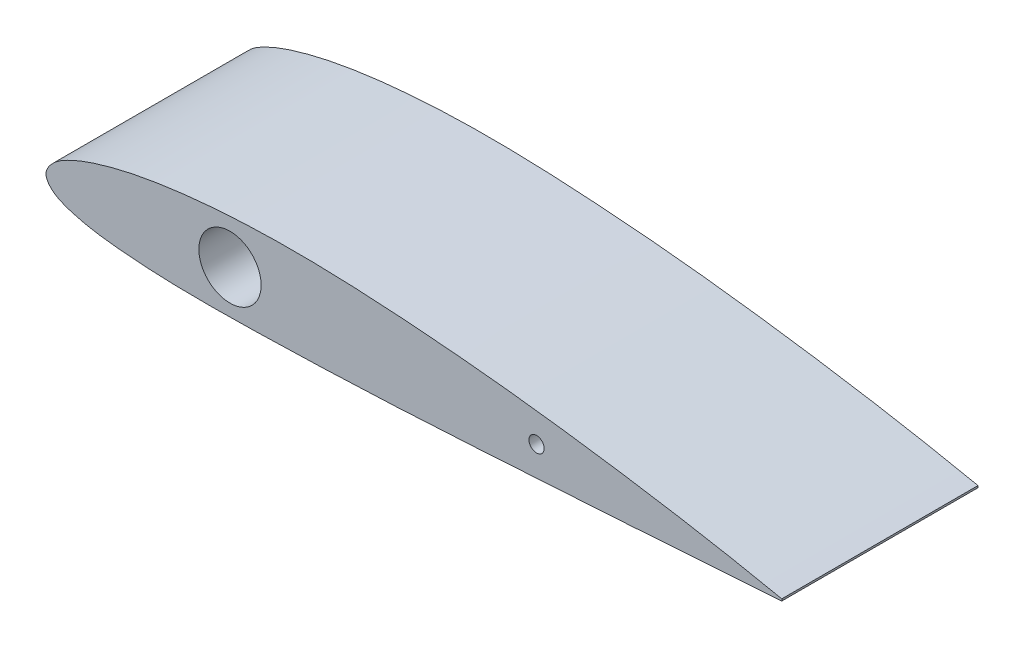
from build123d import *

# Parameters (mm, degrees)
SKETCH1_R           = 12.7
SKETCH1_R_2         = 3.1
BOSS_EXTRUDE1_DEPTH = 80


with BuildPart() as part:
    # Sketch1 → Boss-Extrude1 (new body)
    with BuildSketch(Plane.XY):
        with BuildLine():
            Line((269.75606318, 0.39), (269.75606318, -0.39))
            add(Edge.make_bspline(
                [(269.75606318, 0.39), (264.758836378, 1.414000082), (254.777507596, 3.45931079), (234.797708888, 7.205579334), (209.809502227, 11.35644797), (179.803810027, 15.652495779), (149.803067524, 19.235240906), (119.789318532, 21.858580513), (89.782404697, 23.635097209), (64.746727737, 23.935808407), (44.737918653, 23.107465721), (29.719041415, 21.893704318), (14.681203014, 19.97163417), (2.165982385, 17.604753461), (-7.811397109, 14.926973956), (-15.375659845, 12.492476274), (-21.78446685, 9.655920822), (-27.312645833, 6.216911108), (-32.133405509, 0.269631354), (-27.125920641, -4.957920198), (-21.701145045, -7.342160266), (-15.320533432, -9.153243486), (-7.781174347, -10.451795047), (2.236136575, -11.559964158), (14.740172541, -12.412907572), (29.754296801, -12.754877712), (44.757705477, -12.707223024), (64.759558695, -12.26571363), (89.764209215, -11.471242967), (119.766079926, -10.088623246), (149.759251014, -8.291561108), (179.757509222, -6.423658887), (209.760896614, -4.532938454), (234.755492949, -2.791593222), (254.757335305, -1.448461772), (264.756258336, -0.742836743), (269.75606318, -0.39)],
                knots=[0, 0, 0, 0, 0.02501249, 0.049959286, 0.099672925, 0.14920632, 0.198581097, 0.24780517, 0.296916575, 0.345952722, 0.370491626, 0.395091204, 0.419814796, 0.444798575, 0.457489819, 0.470406405, 0.483879409, 0.49126412, 0.503458853, 0.513609129, 0.520450991, 0.533235388, 0.545691039, 0.558031884, 0.582609167, 0.607134742, 0.63165208, 0.656174272, 0.705233949, 0.754320379, 0.803437364, 0.852566096, 0.901700994, 0.950848809, 0.975422717, 1, 1, 1, 1], degree=3))
        make_face()
        with Locations((44.75606318, 5)):
            Circle(SKETCH1_R, mode=Mode.SUBTRACT)
        with Locations((169.75606318, 5)):
            Circle(SKETCH1_R_2, mode=Mode.SUBTRACT)
    extrude(amount=BOSS_EXTRUDE1_DEPTH)


with BuildPart() as part_1:
    # Body-Move/Copy1: moved
    add(part.part.moved(Location((270, 0, 270))))


solid = part_1.part
